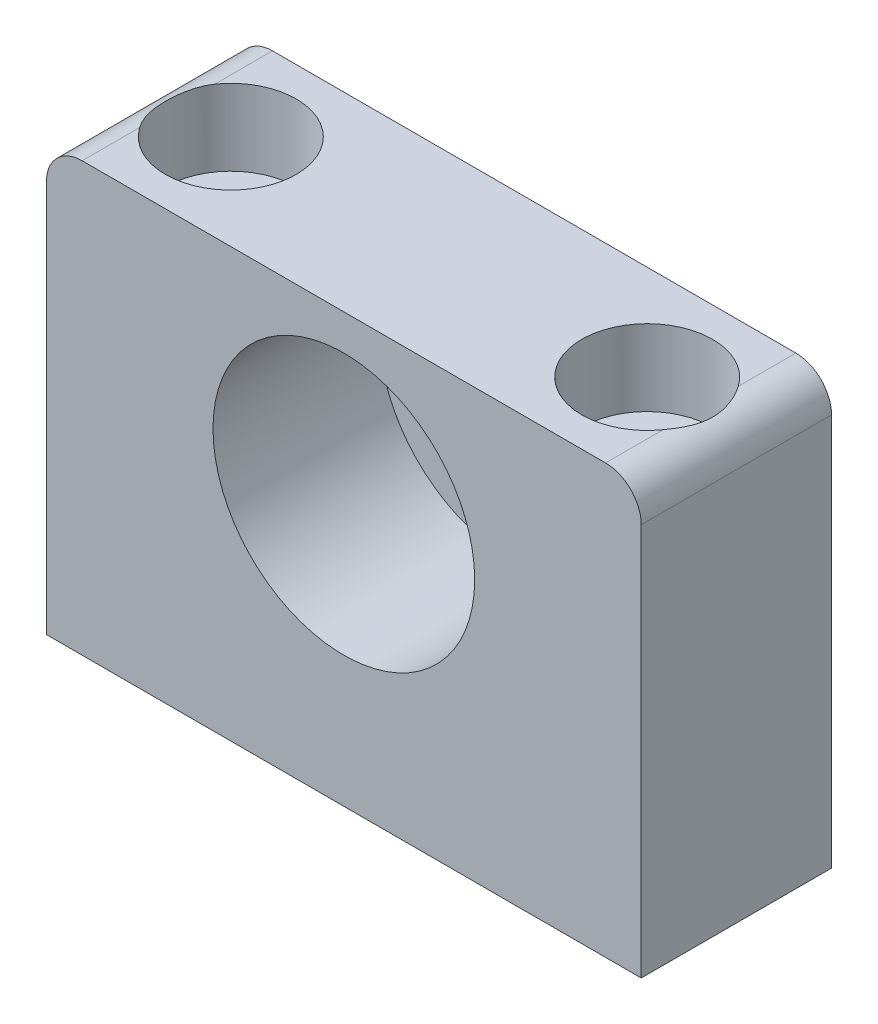
from build123d import *

# Parameters (mm, degrees)
EXTRUDE_349_DEPTH        = 16
HOLE_WIZARD_6_AT_2_COUNT = 2
HOLE_WIZARD_6_AT_2_PITCH = 35
SKETCH_14_R              = 11
CUT_EXTRUDE_608_DEPTH    = 14


with BuildPart() as part:
    # Эскиз8 → Extrude 349 (new body)
    with BuildSketch(Plane.XY):
        with BuildLine():
            Line((-22, 18), (22, 18))
            ThreePointArc((22, 18), (24.121320344, 17.121320344), (25, 15))
            Line((25, 15), (25, -18))
            Line((25, -18), (-25, -18))
            Line((-25, -18), (-25, 15))
            ThreePointArc((-25, 15), (-24.121320344, 17.121320344), (-22, 18))
        make_face()
    extrude(amount=-EXTRUDE_349_DEPTH)

    # Эскиз11 → Крепление-М6 (revolve, cut)
    with BuildSketch(Plane(origin=(-17.5, 18, -8), x_dir=(0, 0, 1), z_dir=(1, 0, 0))):
        Polygon((0, 0), (0, 36), (3.3, 36), (3.3, 6.425), (3.325, 6.4), (5.5, 6.4), (5.5, 0), align=None)
    hole_wizard_6 = revolve(axis=Axis((-17.5, 24.35, -8), (0, -1, 0)), mode=Mode.SUBTRACT)

    # Крепление-М6 at 2: Крепление-М6 ×2
    with Locations(*[(i * HOLE_WIZARD_6_AT_2_PITCH, 0, 0) for i in range(1, HOLE_WIZARD_6_AT_2_COUNT)]):
        add(hole_wizard_6, mode=Mode.SUBTRACT)

    # Эскиз14 → Вырез-608 (cut)
    with BuildSketch(Plane.XY):
        with Locations((0, 4)):
            Circle(SKETCH_14_R)
    extrude(amount=-CUT_EXTRUDE_608_DEPTH, mode=Mode.SUBTRACT)


solid = part.part
